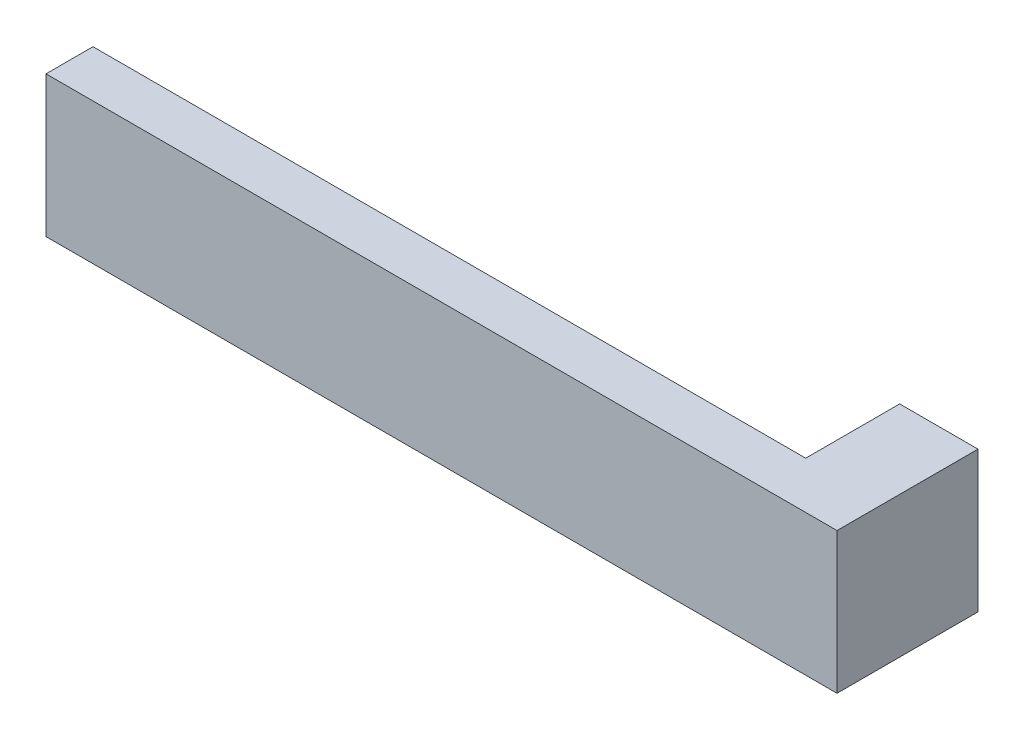
from build123d import *

# Parameters (mm, degrees)
BOSS_EXTRUDE1_DEPTH = 9


with BuildPart() as part:
    # Sketch3 → Boss-Extrude1 (new body)
    with BuildSketch(Plane(origin=(0, 0, 0), x_dir=(1, 0, 0), z_dir=(0, 1, 0))):
        Polygon((38.572571462, -21), (38.572571462, -12), (33.572571462, -12), (33.572571462, -18), (-11.927428538, -18), (-11.927428538, -21), align=None)
    extrude(amount=BOSS_EXTRUDE1_DEPTH)


solid = part.part
